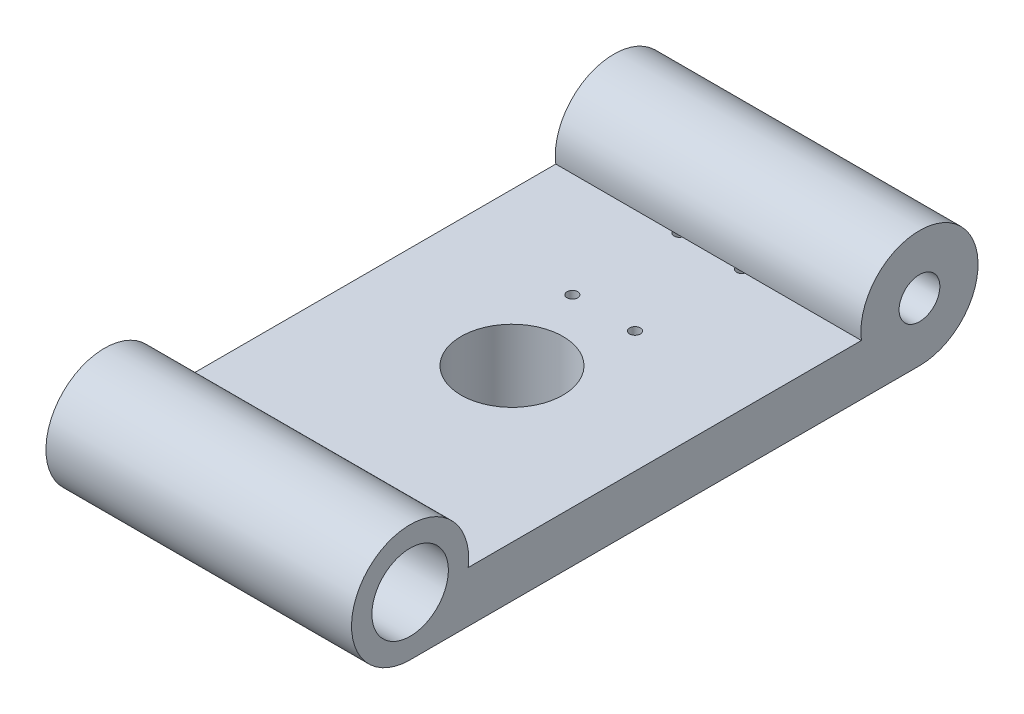
from build123d import *

# Parameters (mm, degrees)
SKETCH1_R           = 7.5
SKETCH1_R_2         = 4
BOSS_EXTRUDE1_DEPTH = 30
SKETCH2_W           = 15
SKETCH2_H           = 12.5
SKETCH3_R           = 10
CUT_EXTRUDE1_DEPTH  = 73.031243221
SKETCH4_R           = 1.05
CUT_EXTRUDE2_DEPTH  = 10


with BuildPart() as part:
    # Sketch1 → Boss-Extrude1 (new, symmetric)
    with BuildSketch(Plane(origin=(0, 0, 0), x_dir=(0, 0, -1), z_dir=(1, 0, 0))):
        with BuildLine():
            Line((-50, -11.5), (50, -11.5))
            ThreePointArc((50, -11.5), (57.582875444, 8.645808233), (38.598245749, -1.5))
            Line((38.598245749, -1.5), (-38.598245749, -1.5))
            ThreePointArc((-38.598245749, -1.5), (-57.582875444, 8.645808233), (-50, -11.5))
        make_face()
        with Locations(Location((-50, 0, 0), (0, 0, 180))):
            Circle(SKETCH1_R, mode=Mode.SUBTRACT)
        with Locations(Location((50, 0, 0), (0, 0, 180))):
            Circle(SKETCH1_R_2, mode=Mode.SUBTRACT)
    extrude(amount=BOSS_EXTRUDE1_DEPTH, both=True)

    # Sketch2 → Revolve1 (revolve)
    with BuildSketch(Plane(origin=(0, 0, 0), x_dir=(0, 0, -1), z_dir=(1, 0, 0))):
        with Locations((7.5, -17.75)):
            Rectangle(SKETCH2_W, SKETCH2_H)
    revolve(axis=Axis((0, -24, 0), (0, 1, 0)))

    # Sketch3 → Cut-Extrude1 (cut, through all)
    with BuildSketch(Plane(origin=(0, -1.5, 0), x_dir=(1, 0, 0), z_dir=(0, 1, 0))):
        with Locations(Location((0, 0, 0), (0, 0, 270))):
            Circle(SKETCH3_R)
    extrude(amount=-CUT_EXTRUDE1_DEPTH, mode=Mode.SUBTRACT)

    # Sketch4 → Cut-Extrude2 (cut)
    with BuildSketch(Plane.XZ.offset(11.5)):
        with Locations(Location((-6.15, -18, 0), (0, 0, 270))):
            Circle(SKETCH4_R)
        with Locations(Location((-6.15, -39, 0), (0, 0, 270))):
            Circle(SKETCH4_R)
        with Locations(Location((6.15, -18, 0), (0, 0, 270))):
            Circle(SKETCH4_R)
        with Locations(Location((6.15, -39, 0), (0, 0, 270))):
            Circle(SKETCH4_R)
    extrude(amount=-CUT_EXTRUDE2_DEPTH, mode=Mode.SUBTRACT)


solid = part.part
